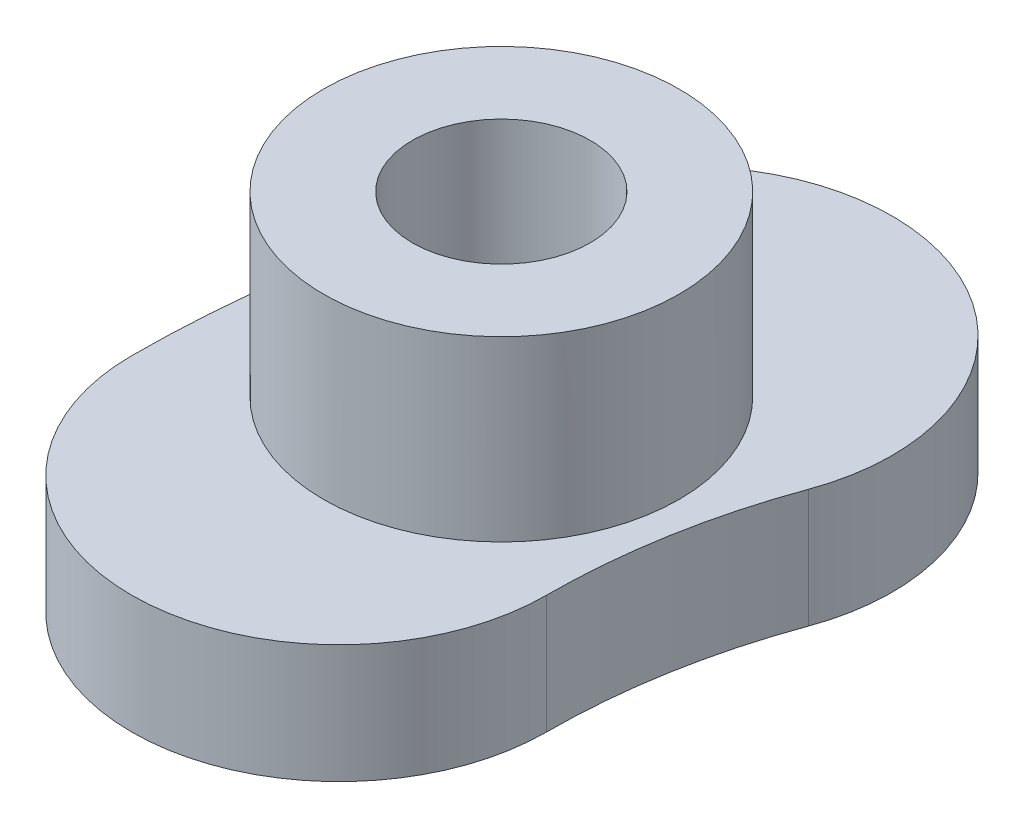
from build123d import *

# Parameters (mm, degrees)
SKETCH_2_R        = 1.5
EXTRUDE_1_DEPTH   = 2
SKETCH_2_3_R      = 3
SKETCH_2_3_R_2    = 1.5
EXTRUDE_1_2_DEPTH = 5


with BuildPart() as part:
    # 草图2 → Extrude 1 (new body)
    with BuildSketch(Plane(origin=(0, 0, 0), x_dir=(1, 0, 0), z_dir=(0, 1, 0))):
        with BuildLine():
            ThreePointArc((-16.914467174, 6.15636258), (-17.726539554, 3.125667198), (-18, 0))
            ThreePointArc((-18, 0), (-14.5, -3.5), (-11, 0))
            ThreePointArc((-11, 0), (-10.832885283, 1.910129954), (-10.336618829, 3.762221577))
            ThreePointArc((-10.336618829, 3.762221577), (-12.4284725, 8.248216251), (-16.914467174, 6.15636258))
        make_face()
        with Locations(Location((-14.279712419, 2.517898576, 0), (0, 0, 270))):
            Circle(SKETCH_2_R, mode=Mode.SUBTRACT)
    extrude(amount=EXTRUDE_1_DEPTH)

    # 草图2<3> → Extrude 1 2 (add)
    with BuildSketch(Plane(origin=(0, 0, 0), x_dir=(1, 0, 0), z_dir=(0, 1, 0))):
        with Locations((-14.279712419, 2.517898576)):
            Circle(SKETCH_2_3_R)
        with Locations((-14.279712419, 2.517898576)):
            Circle(SKETCH_2_3_R_2, mode=Mode.SUBTRACT)
    extrude(amount=EXTRUDE_1_2_DEPTH)


solid = part.part
